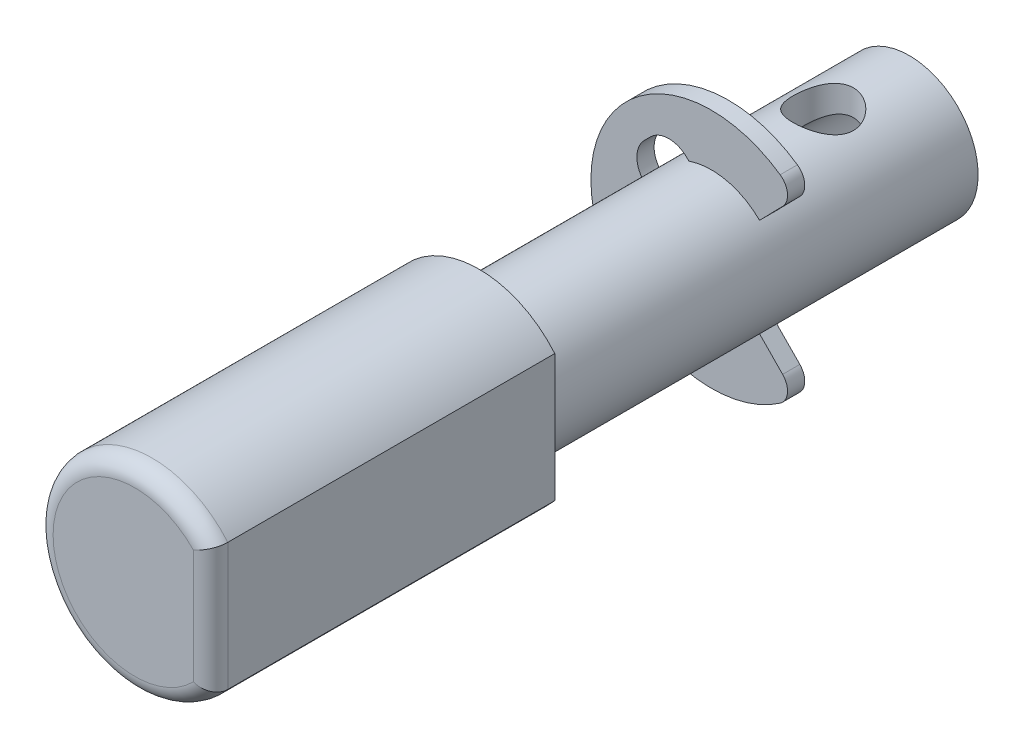
from build123d import *

# Parameters (mm, degrees)
EXTRUDE_1_DEPTH          = 10
FILLET_1_R               = 0.5
SKETCH_2_R               = 2
EXTRUDE_2_DEPTH          = 12.5
EXTRUDE_START            = 0.5
EXTRUDE_3_DEPTH          = 0.5
CUT_EXTRUDE_START        = -0.5
CUT_EXTRUDE_1_DEPTH      = 0.5
FILLET_2_R               = 0.5
HOLE_WIZARD_M31_D        = 2.5
HOLE_WIZARD_M31_DEPTH    = 8.5
HOLE_WIZARD_M31_TIP      = 0.751075774
CUT_EXTRUDE_2_DEPTH      = 10
CUT_EXTRUDE_2_DEPTH_BACK = 10
SKETCH_8_R               = 0.875


with BuildPart() as part:
    # Эскиз1 → Бобышка-Вытянуть1 (new body)
    with BuildSketch(Plane.XY):
        with BuildLine():
            Line((2.2, -1.850844402), (2.2, 1.850844402))
            ThreePointArc((2.2, 1.850844402), (-2.875, 0), (2.2, -1.850844402))
        make_face()
    extrude(amount=EXTRUDE_1_DEPTH)

    # Скругление1
    fillet_1_edges = [part.edges().sort_by_distance(p)[0] for p in [
        (2.2, 0, 10),
        (-2.875, 0, 10),
    ]]
    fillet(fillet_1_edges, radius=FILLET_1_R)

    # Эскиз2 → Бобышка-Вытянуть2 (add)
    with BuildSketch(Plane(origin=(0, 0, 0), x_dir=(-1, 0, 0), z_dir=(0, 0, -1))):
        Circle(SKETCH_2_R)
    extrude(amount=EXTRUDE_2_DEPTH)

    # Эскиз3 → Бобышка-Вытянуть3 (add)
    with BuildSketch(Plane.XY.offset(-7.25).offset(EXTRUDE_START)):
        with BuildLine():
            Line((2.449489743, -2.5), (1.399708424, -1.428571429))
            ThreePointArc((1.399708424, -1.428571429), (-2, 0), (1.399708424, 1.428571429))
            Line((1.399708424, 1.428571429), (2.449489743, 2.5))
            ThreePointArc((2.449489743, 2.5), (-3.5, 0), (2.449489743, -2.5))
        make_face()
    extrude(amount=-EXTRUDE_3_DEPTH)

    # Эскиз4 → Вырез-Вытянуть1 (cut)
    with BuildSketch(Plane(origin=(0, 0, -7.25), x_dir=(-1, 0, 0), z_dir=(0, 0, -1)).offset(CUT_EXTRUDE_START)):
        with BuildLine():
            Line((1.944543648, -1.767766953), (1.767766953, -1.944543648))
            ThreePointArc((1.767766953, -1.944543648), (1.237436867, -2.164213562), (0.707106781, -1.944543648))
            Line((0.707106781, -1.944543648), (0.652968438, -1.890405305))
            ThreePointArc((0.652968438, -1.890405305), (1.414213562, -1.414213562), (1.890405305, -0.652968438))
            Line((1.890405305, -0.652968438), (1.944543648, -0.707106781))
            ThreePointArc((1.944543648, -0.707106781), (2.164213562, -1.237436867), (1.944543648, -1.767766953))
        make_face()
        with BuildLine():
            Line((1.767766953, 1.944543648), (1.944543648, 1.767766953))
            ThreePointArc((1.944543648, 1.767766953), (2.164213562, 1.237436867), (1.944543648, 0.707106781))
            Line((1.944543648, 0.707106781), (1.890405305, 0.652968438))
            ThreePointArc((1.890405305, 0.652968438), (1.414213562, 1.414213562), (0.652968438, 1.890405305))
            Line((0.652968438, 1.890405305), (0.707106781, 1.944543648))
            ThreePointArc((0.707106781, 1.944543648), (1.237436867, 2.164213562), (1.767766953, 1.944543648))
        make_face()
    extrude(amount=CUT_EXTRUDE_1_DEPTH, mode=Mode.SUBTRACT)

    # Скругление2
    fillet_2_edges = [part.edges().sort_by_distance(p)[0] for p in [
        (2.449489743, -2.5, -7),
        (2.449489743, 2.5, -7),
    ]]
    fillet(fillet_2_edges, radius=FILLET_2_R)

    # Отверстие обработанное метчиком M31
    with Locations(Plane(origin=(0, 0, -12.5), x_dir=(-1, 0, 0), z_dir=(0, 0, -1))):
        with Locations((0, 0)):
            Hole(HOLE_WIZARD_M31_D / 2, depth=HOLE_WIZARD_M31_DEPTH)
            with Locations((0, 0, -(HOLE_WIZARD_M31_DEPTH + HOLE_WIZARD_M31_TIP / 2))):  # 118° drill point
                Cone(0, HOLE_WIZARD_M31_D / 2, HOLE_WIZARD_M31_TIP, mode=Mode.SUBTRACT)

    # Эскиз8 → Вырез-Вытянуть2 (cut, two sides: drawn at the far end of the back side and taken through both)
    with BuildSketch(Plane(origin=(0, 0, 0), x_dir=(1, 0, 0), z_dir=(0, 1, 0)).offset(-CUT_EXTRUDE_2_DEPTH_BACK)):
        with Locations((0, 10)):
            Circle(SKETCH_8_R)
    extrude(amount=CUT_EXTRUDE_2_DEPTH + CUT_EXTRUDE_2_DEPTH_BACK, mode=Mode.SUBTRACT)


solid = part.part
